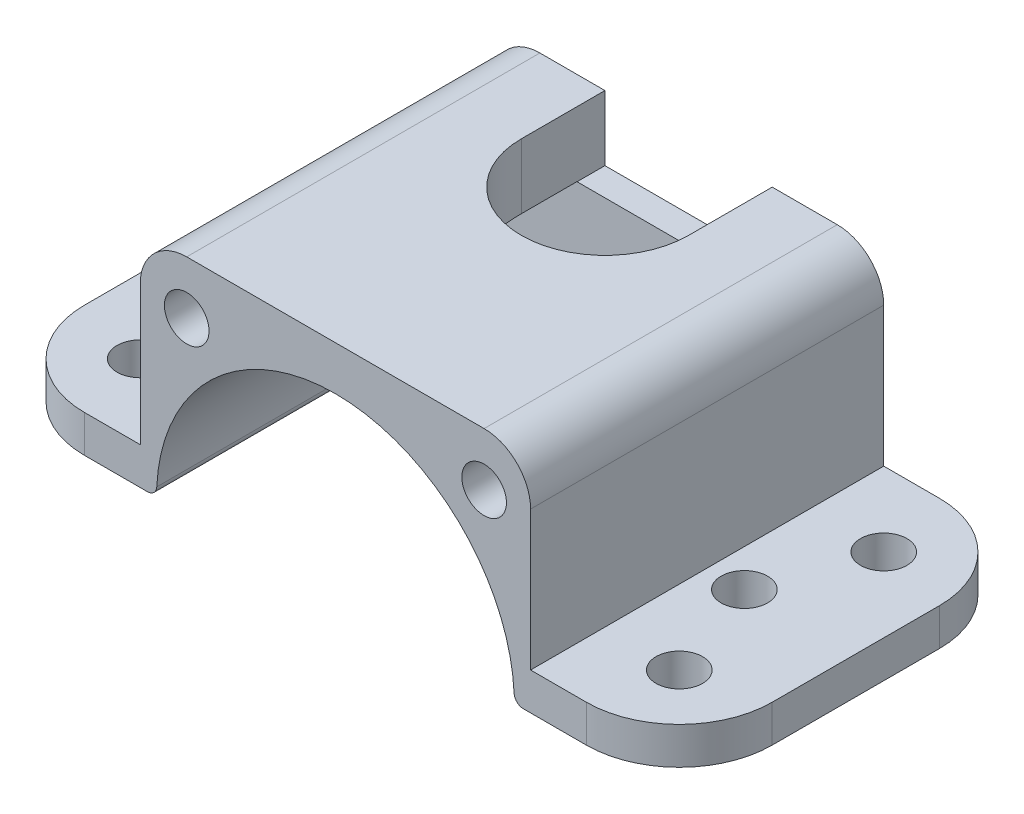
from build123d import *

# Parameters (mm, degrees)
SKETCH1_W           = 42
SKETCH1_H           = 48
SKETCH1_R           = 19.25
SKETCH1_R_2         = 2.4
BOSS_EXTRUDE1_DEPTH = 35
SKETCH4_W           = 19
SKETCH4_H           = 5
BOSS_EXTRUDE3_DEPTH = 35
CUT_EXTRUDE1_REACH  = 70.367
SKETCH5_R           = 2.5
BOSS_EXTRUDE4_DEPTH = 3
CUT_EXTRUDE2_REACH  = 62.166
SKETCH9_W           = 16
SKETCH9_H           = 4
BOSS_EXTRUDE6_DEPTH = 38
CUT_EXTRUDE3_REACH  = 58.683
SKETCH10_R          = 2.5
FILLET1_R           = 10
FILLET2_R           = 5
SKETCH11_R          = 2.4
CUT_EXTRUDE4_DEPTH  = 57.302753041
FILLET3_R           = 1
CUT_EXTRUDE7_DEPTH  = 7


with BuildPart() as part:
    # Sketch1 → Boss-Extrude1 (new body)
    with BuildSketch(Plane.XY):
        Rectangle(SKETCH1_W, SKETCH1_H)
        Circle(SKETCH1_R, mode=Mode.SUBTRACT)
        with Locations((-16, 18.285714286)):
            Circle(SKETCH1_R_2, mode=Mode.SUBTRACT)
        with Locations((16, 18.285714286)):
            Circle(SKETCH1_R_2, mode=Mode.SUBTRACT)
        with Locations((16, -18.285714286)):
            Circle(SKETCH1_R_2, mode=Mode.SUBTRACT)
        with Locations((-16, -18.285714286)):
            Circle(SKETCH1_R_2, mode=Mode.SUBTRACT)
    extrude(amount=-BOSS_EXTRUDE1_DEPTH)

    # Sketch4 → Boss-Extrude3 (add)
    with BuildSketch(Plane.XY):
        with Locations((-30.5, -21.5)):
            Rectangle(SKETCH4_W, SKETCH4_H)
        with Locations((30.5, -21.5)):
            Rectangle(SKETCH4_W, SKETCH4_H)
    extrude(amount=-BOSS_EXTRUDE3_DEPTH)

    # Sketch5 → Cut-Extrude1 (cut, up to next)
    with BuildSketch(Plane(origin=(0, -19, 0), x_dir=(1, 0, 0), z_dir=(0, 1, 0)), mode=Mode.PRIVATE) as cut_extrude1_sk1:
        with Locations(Location((-25, 19, 0), (0, 0, 270))):
            Circle(SKETCH5_R)
    cut_extrude1_tool1 = extrude(cut_extrude1_sk1.sketch, amount=-CUT_EXTRUDE1_REACH, mode=Mode.PRIVATE) & part.part
    # Sketch5 → Cut-Extrude1 (cut, up to next)
    with BuildSketch(Plane(origin=(0, -19, 0), x_dir=(1, 0, 0), z_dir=(0, 1, 0)), mode=Mode.PRIVATE) as cut_extrude1_sk2:
        with Locations(Location((25, 19, 0), (0, 0, 270))):
            Circle(SKETCH5_R)
    cut_extrude1_tool2 = extrude(cut_extrude1_sk2.sketch, amount=-CUT_EXTRUDE1_REACH, mode=Mode.PRIVATE) & part.part
    add(cut_extrude1_tool1.solids().sort_by_distance((-25, -19, -19))[0], mode=Mode.SUBTRACT)
    add(cut_extrude1_tool2.solids().sort_by_distance((25, -19, -19))[0], mode=Mode.SUBTRACT)

    # Sketch6 → Boss-Extrude4 (add)
    with BuildSketch(Plane(origin=(0, 0, -35), x_dir=(-1, 0, 0), z_dir=(0, 0, -1))):
        Polygon((-21, 24), (-21, -19), (-40, -19), (-40, -24), (40, -24), (40, -19), (21, -19), (21, 24), align=None)
    extrude(amount=BOSS_EXTRUDE4_DEPTH)

    # Sketch7 → Cut-Extrude2 (cut, up to next)
    with BuildSketch(Plane.XY, mode=Mode.PRIVATE) as cut_extrude2_sk1:
        Polygon((-21, 0), (21, 0), (21, -19), (40, -19), (40, -24), (-40, -24), (-40, -19), (-21, -19), align=None)
    cut_extrude2_tool1 = extrude(cut_extrude2_sk1.sketch, amount=-CUT_EXTRUDE2_REACH, mode=Mode.PRIVATE) & part.part
    add(cut_extrude2_tool1.solids().sort_by_distance((0, -13.506678, 0))[0], mode=Mode.SUBTRACT)

    # Sketch9 → Boss-Extrude6 (add)
    with BuildSketch(Plane.XY):
        with Locations((-29, 2)):
            Rectangle(SKETCH9_W, SKETCH9_H)
        with Locations((29, 2)):
            Rectangle(SKETCH9_W, SKETCH9_H)
    extrude(amount=-BOSS_EXTRUDE6_DEPTH)

    # Sketch10 → Cut-Extrude3 (cut, up to next)
    with BuildSketch(Plane(origin=(0, 4, 0), x_dir=(1, 0, 0), z_dir=(0, 1, 0)), mode=Mode.PRIVATE) as cut_extrude3_sk1:
        with Locations(Location((-29, 8, 0), (0, 0, 180))):
            Circle(SKETCH10_R)
    cut_extrude3_tool1 = extrude(cut_extrude3_sk1.sketch, amount=-CUT_EXTRUDE3_REACH, mode=Mode.PRIVATE) & part.part
    # Sketch10 → Cut-Extrude3 (cut, up to next)
    with BuildSketch(Plane(origin=(0, 4, 0), x_dir=(1, 0, 0), z_dir=(0, 1, 0)), mode=Mode.PRIVATE) as cut_extrude3_sk2:
        with Locations(Location((-29, 30, 0), (0, 0, 180))):
            Circle(SKETCH10_R)
    cut_extrude3_tool2 = extrude(cut_extrude3_sk2.sketch, amount=-CUT_EXTRUDE3_REACH, mode=Mode.PRIVATE) & part.part
    # Sketch10 → Cut-Extrude3 (cut, up to next)
    with BuildSketch(Plane(origin=(0, 4, 0), x_dir=(1, 0, 0), z_dir=(0, 1, 0)), mode=Mode.PRIVATE) as cut_extrude3_sk3:
        with Locations(Location((29, 30, 0), (0, 0, 270))):
            Circle(SKETCH10_R)
    cut_extrude3_tool3 = extrude(cut_extrude3_sk3.sketch, amount=-CUT_EXTRUDE3_REACH, mode=Mode.PRIVATE) & part.part
    # Sketch10 → Cut-Extrude3 (cut, up to next)
    with BuildSketch(Plane(origin=(0, 4, 0), x_dir=(1, 0, 0), z_dir=(0, 1, 0)), mode=Mode.PRIVATE) as cut_extrude3_sk4:
        with Locations(Location((29, 8, 0), (0, 0, 270))):
            Circle(SKETCH10_R)
    cut_extrude3_tool4 = extrude(cut_extrude3_sk4.sketch, amount=-CUT_EXTRUDE3_REACH, mode=Mode.PRIVATE) & part.part
    # Sketch10 → Cut-Extrude3 (cut, up to next)
    with BuildSketch(Plane(origin=(0, 4, 0), x_dir=(1, 0, 0), z_dir=(0, 1, 0)), mode=Mode.PRIVATE) as cut_extrude3_sk5:
        with Locations(Location((-25, 19, 0), (0, 0, 180))):
            Circle(SKETCH10_R)
    cut_extrude3_tool5 = extrude(cut_extrude3_sk5.sketch, amount=-CUT_EXTRUDE3_REACH, mode=Mode.PRIVATE) & part.part
    # Sketch10 → Cut-Extrude3 (cut, up to next)
    with BuildSketch(Plane(origin=(0, 4, 0), x_dir=(1, 0, 0), z_dir=(0, 1, 0)), mode=Mode.PRIVATE) as cut_extrude3_sk6:
        with Locations(Location((25, 19, 0), (0, 0, 270))):
            Circle(SKETCH10_R)
    cut_extrude3_tool6 = extrude(cut_extrude3_sk6.sketch, amount=-CUT_EXTRUDE3_REACH, mode=Mode.PRIVATE) & part.part
    add(cut_extrude3_tool1.solids().sort_by_distance((-29, 4, -8))[0], mode=Mode.SUBTRACT)
    add(cut_extrude3_tool2.solids().sort_by_distance((-29, 4, -30))[0], mode=Mode.SUBTRACT)
    add(cut_extrude3_tool3.solids().sort_by_distance((29, 4, -30))[0], mode=Mode.SUBTRACT)
    add(cut_extrude3_tool4.solids().sort_by_distance((29, 4, -8))[0], mode=Mode.SUBTRACT)
    add(cut_extrude3_tool5.solids().sort_by_distance((-25, 4, -19))[0], mode=Mode.SUBTRACT)
    add(cut_extrude3_tool6.solids().sort_by_distance((25, 4, -19))[0], mode=Mode.SUBTRACT)

    # Fillet1
    fillet1_edges = [part.edges().sort_by_distance(p)[0] for p in [
        (-37, 2, 0),
        (-37, 2, -38),
        (37, 2, 0),
        (37, 2, -38),
    ]]
    fillet(fillet1_edges, radius=FILLET1_R)

    # Fillet2
    fillet2_edges = [part.edges().sort_by_distance(p)[0] for p in [
        (-21, 24, -19),
        (21, 24, -19),
    ]]
    fillet(fillet2_edges, radius=FILLET2_R)

    # Sketch11 → Cut-Extrude4 (cut, through all)
    with BuildSketch(Plane.XY.offset(-35)):
        with Locations((16, 18.285714286)):
            Circle(SKETCH11_R)
        with Locations((-16, 18.285714286)):
            Circle(SKETCH11_R)
    extrude(amount=-CUT_EXTRUDE4_DEPTH, mode=Mode.SUBTRACT)

    # Fillet3
    fillet3_edges = [part.edges().sort_by_distance(p)[0] for p in [
        (-19.25, 0, -17.5),
        (19.25, 0, -17.5),
    ]]
    fillet(fillet3_edges, radius=FILLET3_R)

    # Sketch12 → Cut-Extrude7 (cut)
    with BuildSketch(Plane(origin=(0, 24, 0), x_dir=(1, 0, 0), z_dir=(0, 1, 0))):
        with BuildLine():
            ThreePointArc((1.6e-08, 38), (-6.363961025, 35.363961036), (-9, 29))
            Line((-9, 29), (9, 29))
            ThreePointArc((9, 29), (6.363961036, 35.363961025), (1.6e-08, 38))
        make_face()
        with BuildLine():
            Line((9, 29), (-9, 29))
            ThreePointArc((-9, 29), (0, 20), (9, 29))
        make_face()
        with BuildLine():
            ThreePointArc((1.6e-08, 38), (6.363961036, 35.363961025), (9, 29))
            Line((9, 29), (9, 38))
            Line((9, 38), (1.6e-08, 38))
        make_face()
        with BuildLine():
            Line((-9, 38), (-9, 29))
            ThreePointArc((-9, 29), (-6.363961025, 35.363961036), (1.6e-08, 38))
            Line((1.6e-08, 38), (-9, 38))
        make_face()
    extrude(amount=-CUT_EXTRUDE7_DEPTH, mode=Mode.SUBTRACT)


solid = part.part
